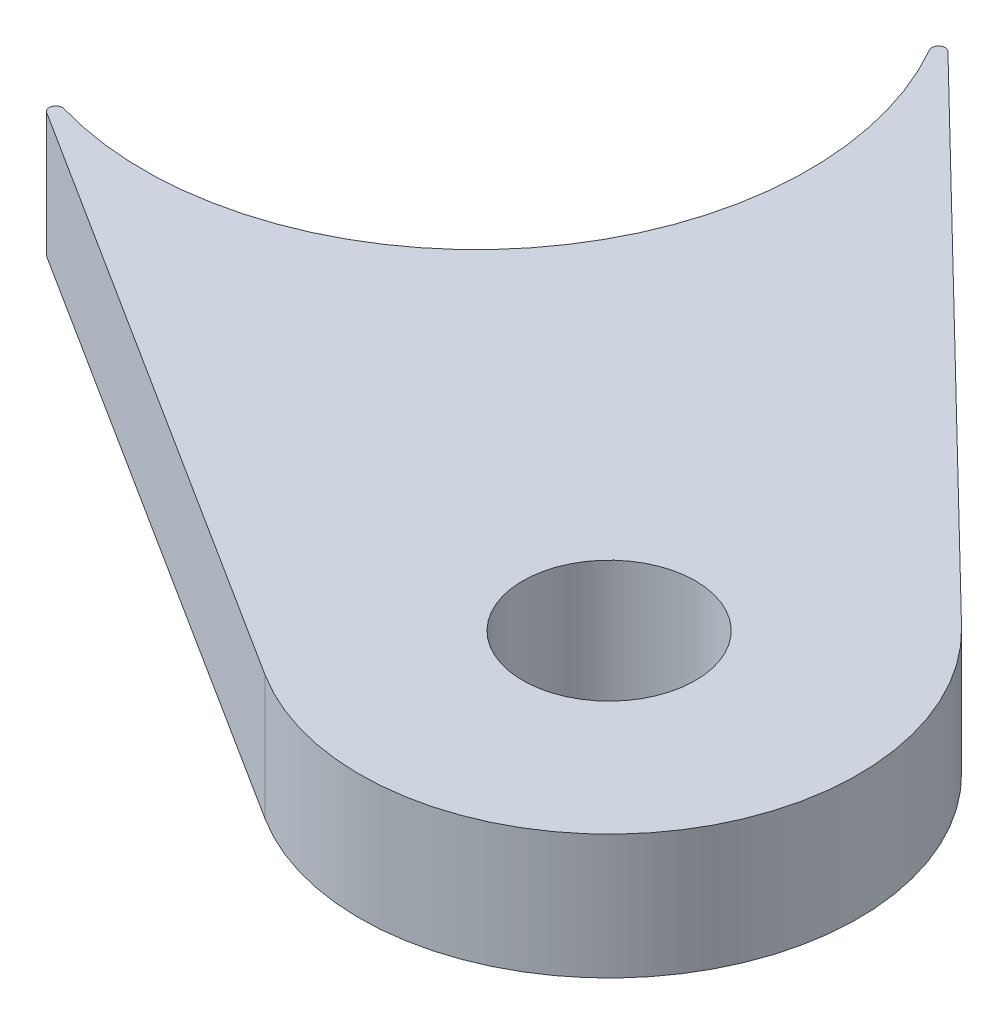
from build123d import *

# Parameters (mm, degrees)
SKETCH1_R           = 3.3
BOSS_EXTRUDE1_DEPTH = 4.7625
FILLET1_R           = 0.254


with BuildPart() as part:
    # Sketch1 → Boss-Extrude1 (new body)
    with BuildSketch(Plane(origin=(0, 0, 0), x_dir=(1, 0, 0), z_dir=(0, 1, 0))):
        with BuildLine():
            Line((20.295130547, -4.286001307), (-1.62065927, 17.039498258))
            ThreePointArc((-1.62065927, 17.039498258), (-0.509488878, 0.068017535), (-17.27546701, -2.789924879))
            Line((-17.27546701, -2.789924879), (8.554024743, -19.158068659))
            ThreePointArc((8.554024743, -19.158068659), (21.128508342, -17.014611849), (20.295130547, -4.286001307))
        make_face()
        with Locations(Location((13.6525, -11.1125, 0), (0, 0, 90))):
            Circle(SKETCH1_R, mode=Mode.SUBTRACT)
    extrude(amount=BOSS_EXTRUDE1_DEPTH)

    # Fillet1
    fillet1_edges = [part.edges().sort_by_distance(p)[0] for p in [
        (-17.27546701, 2.38125, 2.789924879),
        (-1.62065927, 2.38125, -17.039498258),
    ]]
    fillet(fillet1_edges, radius=FILLET1_R)


solid = part.part
